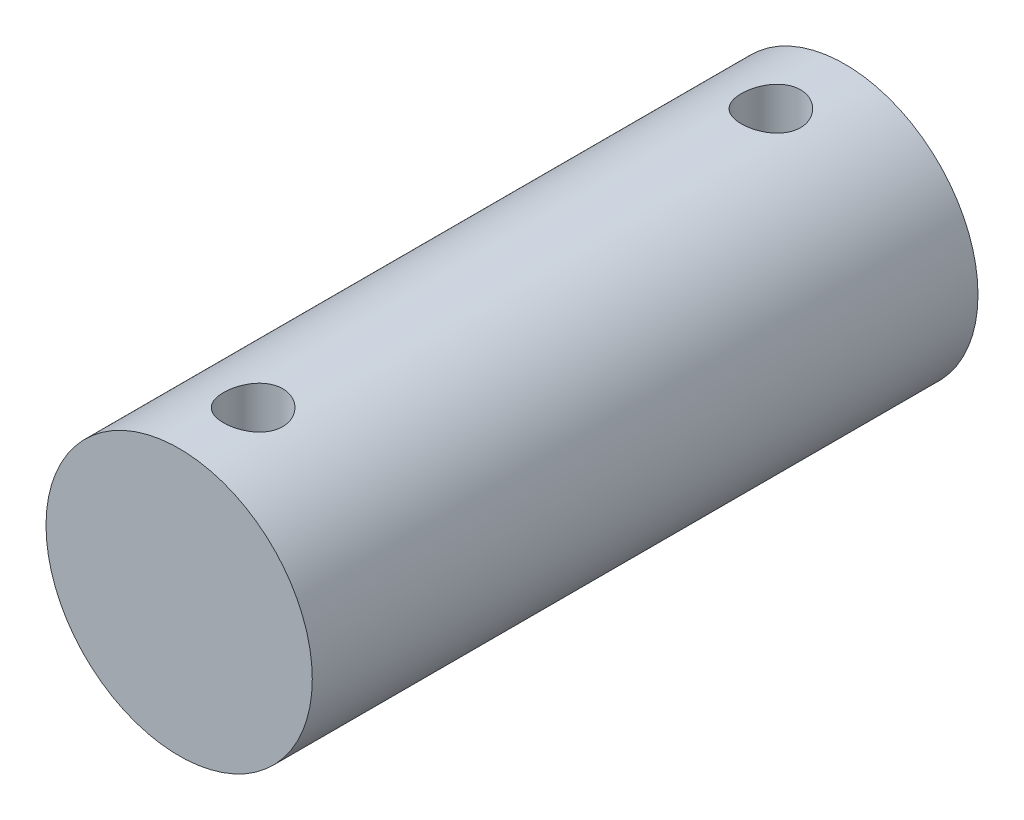
from build123d import *

# Parameters (mm, degrees)
SKETCH1_R               = 9
BOSS_EXTRUDE1_DEPTH     = 12.5
SKETCH2_R               = 9
BOSS_EXTRUDE2_DEPTH     = 10
CUT_EXTRUDE1_DEPTH      = 26.850531909
CUT_EXTRUDE1_DEPTH_BACK = 26.850531909
SKETCH3_R               = 2


with BuildPart() as part:
    # Sketch1 → Boss-Extrude1 (new body)
    with BuildSketch(Plane.XY):
        Circle(SKETCH1_R)
    extrude(amount=BOSS_EXTRUDE1_DEPTH)

    # Sketch2 → Boss-Extrude2 (add)
    with BuildSketch(Plane.XY.offset(12.5)):
        Circle(SKETCH2_R)
    extrude(amount=BOSS_EXTRUDE2_DEPTH)

    # Sketch3 → Cut-Extrude1 (cut, two sides: drawn at the far end of the back side and taken through both)
    with BuildSketch(Plane(origin=(0, 0, 0), x_dir=(1, 0, 0), z_dir=(0, 1, 0)).offset(-CUT_EXTRUDE1_DEPTH_BACK)):
        with Locations(Location((0, -17.5, 0), (0, 0, 270))):
            Circle(SKETCH3_R)
    extrude(amount=CUT_EXTRUDE1_DEPTH + CUT_EXTRUDE1_DEPTH_BACK, mode=Mode.SUBTRACT)

    # Mirror1: part across plane


with BuildPart() as part_1:
    add(part.part)
    add(part.part.mirror(Plane.XY))


solid = part_1.part
